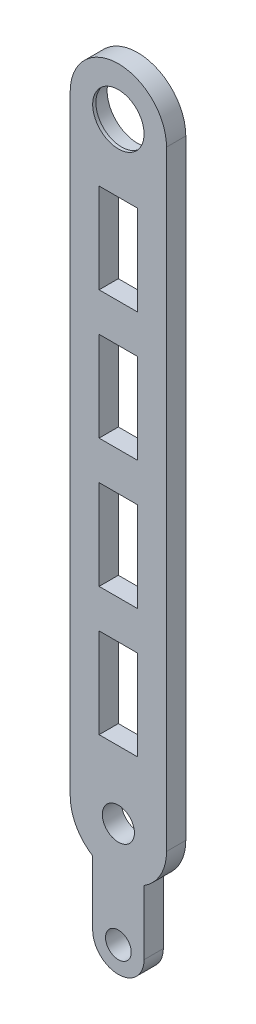
from build123d import *

# Parameters (mm, degrees)
SKETCH_1_R          = 9.5
SKETCH_1_R_2        = 5
SKETCH_1_R_3        = 4
EXTRUDE_2_DEPTH     = 6
SKETCH_2_W          = 12
SKETCH_2_H          = 28
CUT_EXTRUDE_1_DEPTH = 6
EXTRUDE_START       = -1
SKETCH_4_R          = 9.5
SKETCH_4_R_2        = 8
EXTRUDE_4_DEPTH     = 1


with BuildPart() as part:
    # 草图1 → 凸台-拉伸2 (new body)
    with BuildSketch(Plane.XY):
        with BuildLine():
            Line((-8, -127.68857754), (-8, -107.68857754))
            ThreePointArc((-8, -107.68857754), (-13.133925537, -102.245688373), (-15, -95))
            Line((-15, -95), (-15, 95))
            ThreePointArc((-15, 95), (0, 110), (15, 95))
            Line((15, 95), (15, -95))
            ThreePointArc((15, -95), (13.133925537, -102.245688373), (8, -107.68857754))
            Line((8, -107.68857754), (8, -127.68857754))
            ThreePointArc((8, -127.68857754), (0, -135.68857754), (-8, -127.68857754))
        make_face()
        with Locations((0, 95)):
            Circle(SKETCH_1_R, mode=Mode.SUBTRACT)
        with Locations((0, -95)):
            Circle(SKETCH_1_R_2, mode=Mode.SUBTRACT)
        with Locations((0, -127.68857754)):
            Circle(SKETCH_1_R_3, mode=Mode.SUBTRACT)
    extrude(amount=EXTRUDE_2_DEPTH)

    # 草图2 → 切除-拉伸1 (cut)
    with BuildSketch(Plane.XY.offset(6)):
        with Locations((0, 60)):
            Rectangle(SKETCH_2_W, SKETCH_2_H)
        with Locations((0, 20)):
            Rectangle(SKETCH_2_W, SKETCH_2_H)
        with Locations((0, -20)):
            Rectangle(SKETCH_2_W, SKETCH_2_H)
        with Locations((0, -60)):
            Rectangle(SKETCH_2_W, SKETCH_2_H)
    extrude(amount=-CUT_EXTRUDE_1_DEPTH, mode=Mode.SUBTRACT)

    # 草图4 → 凸台-拉伸4 (add)
    with BuildSketch(Plane.XY.offset(6).offset(EXTRUDE_START)):
        with Locations((0, 95)):
            Circle(SKETCH_4_R)
        with Locations((0, 95)):
            Circle(SKETCH_4_R_2, mode=Mode.SUBTRACT)
    extrude(amount=EXTRUDE_4_DEPTH)


solid = part.part
